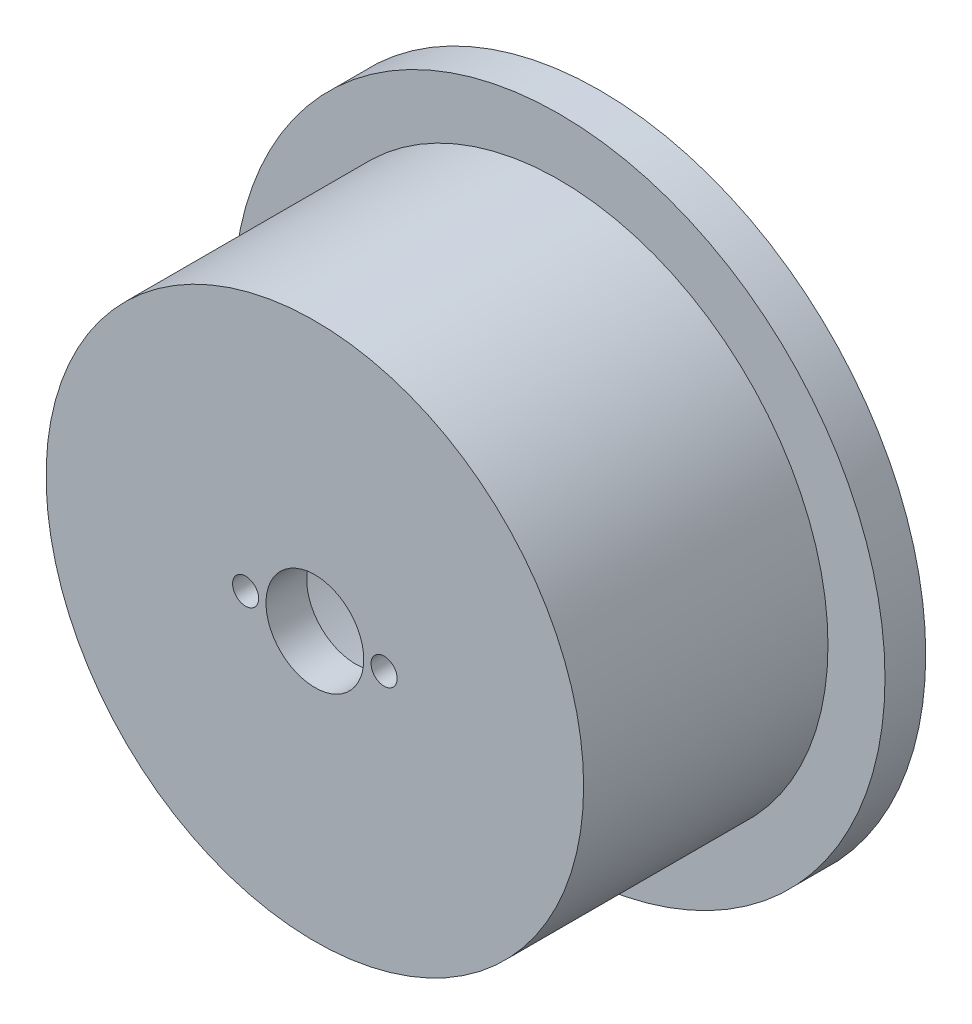
from build123d import *

# Parameters (mm, degrees)
SKETCH1_R           = 40
SKETCH1_R_2         = 28
FLANGE_DEPTH        = 5
SKETCH2_R           = 33
SKETCH2_R_2         = 28
TUBE_DEPTH          = 25
SKETCH3_R           = 33
PLATE_DEPTH         = 5
SKETCH4_R           = 6
SHAFT_HOLE_DEPTH    = 5
SKETCH5_R           = 1.6
MOTOR_SCREWS_DEPTH  = 5
SKETCH6_R           = 1.7
GROMMET_HOLES_DEPTH = 5


with BuildPart() as part:
    # Sketch1 → Flange (new body)
    with BuildSketch(Plane.XY):
        Circle(SKETCH1_R)
        Circle(SKETCH1_R_2, mode=Mode.SUBTRACT)
    extrude(amount=FLANGE_DEPTH)

    # Sketch2 → Tube (add)
    with BuildSketch(Plane.XY.offset(5)):
        Circle(SKETCH2_R)
        Circle(SKETCH2_R_2, mode=Mode.SUBTRACT)
    extrude(amount=TUBE_DEPTH)

    # Sketch3 → Plate (add)
    with BuildSketch(Plane.XY.offset(30)):
        Circle(SKETCH3_R)
    extrude(amount=PLATE_DEPTH)

    # Sketch4 → Shaft_hole (cut)
    with BuildSketch(Plane.XY.offset(30)):
        Circle(SKETCH4_R)
    extrude(amount=SHAFT_HOLE_DEPTH, mode=Mode.SUBTRACT)

    # Sketch5 → Motor_screws (cut)
    with BuildSketch(Plane.XY.offset(30)):
        with Locations((-8.5, 0)):
            Circle(SKETCH5_R)
        with Locations((8.5, 0)):
            Circle(SKETCH5_R)
    extrude(amount=MOTOR_SCREWS_DEPTH, mode=Mode.SUBTRACT)

    # Sketch6 → Grommet_holes (cut)
    with BuildSketch(Plane.XY):
        with Locations((21.213203436, 21.213203436)):
            Circle(SKETCH6_R)
        with Locations((-21.213203436, 21.213203436)):
            Circle(SKETCH6_R)
        with Locations((-21.213203436, -21.213203436)):
            Circle(SKETCH6_R)
        with Locations((21.213203436, -21.213203436)):
            Circle(SKETCH6_R)
    extrude(amount=GROMMET_HOLES_DEPTH, mode=Mode.SUBTRACT)


solid = part.part
